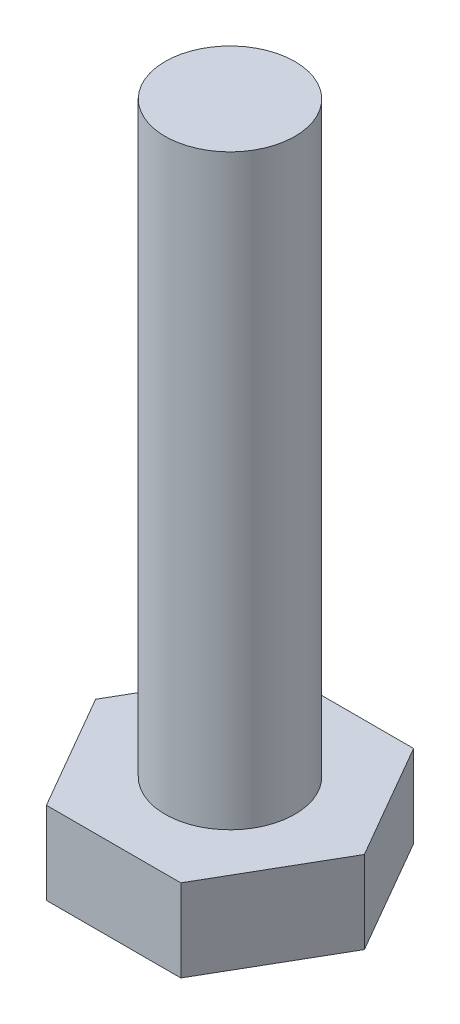
from build123d import *

# Parameters (mm, degrees)
BOSS_EXTRUDE1_DEPTH = 4
SKETCH2_R           = 3.15
BOSS_EXTRUDE2_DEPTH = 28.5


with BuildPart() as part:
    # Sketch1 → Boss-Extrude1 (new body)
    with BuildSketch(Plane(origin=(0, 0, 0), x_dir=(1, 0, 0), z_dir=(0, 1, 0))):
        Polygon((-3.262029021, 5.65), (3.262029021, 5.65), (6.524058042, 0), (3.262029021, -5.65), (-3.262029021, -5.65), (-6.524058042, 0), align=None)
    extrude(amount=BOSS_EXTRUDE1_DEPTH)

    # Sketch2 → Boss-Extrude2 (add)
    with BuildSketch(Plane(origin=(0, 4, 0), x_dir=(1, 0, 0), z_dir=(0, 1, 0))):
        with Locations(Location((0, 0, 0), (0, 0, 90))):
            Circle(SKETCH2_R)
    extrude(amount=BOSS_EXTRUDE2_DEPTH)


solid = part.part
